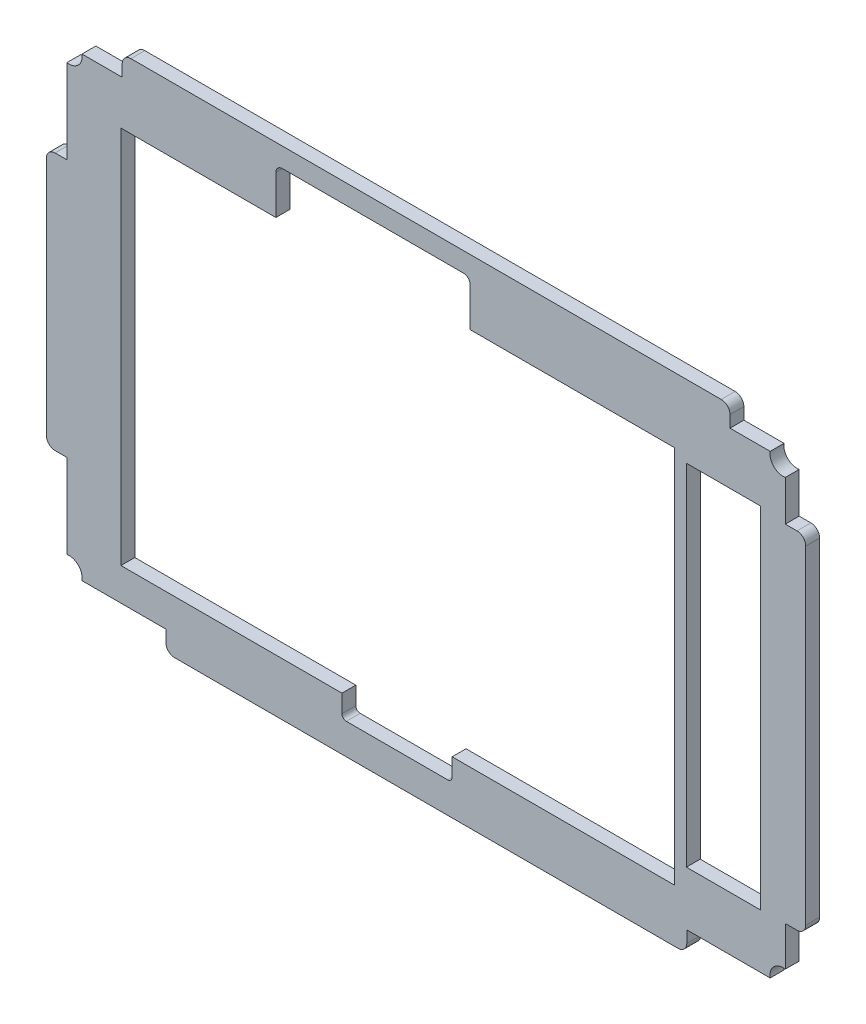
from build123d import *

# Parameters (mm, degrees)
BOSS_EXTRUDE1_DEPTH = 1.5875
SKETCH3_R           = 1.5
CUT_EXTRUDE1_DEPTH  = 1.5875
SKETCH4_W           = 8.5
SKETCH4_H           = 40
CUT_EXTRUDE2_DEPTH  = 52.910426175
CUT_EXTRUDE3_DEPTH  = 52.910426175


with BuildPart() as part:
    # Sketch2 → Boss-Extrude1 (new body)
    with BuildSketch(Plane.XY):
        with BuildLine():
            Line((41.075, 26.06487963), (34.753871084, 26.06487963))
            Line((34.753871084, 26.06487963), (34.753871084, 27.4075156))
            ThreePointArc((34.753871084, 27.4075156), (34.460977865, 28.114622381), (33.753871084, 28.4075156))
            Line((33.753871084, 28.4075156), (-33.743187521, 28.4075156))
            ThreePointArc((-33.743187521, 28.4075156), (-34.450294302, 28.114622381), (-34.743187521, 27.4075156))
            Line((-34.743187521, 27.4075156), (-34.743187521, 26.06487963))
            Line((-34.743187521, 26.06487963), (-41.075, 26.06487963))
            Line((-41.075, 26.06487963), (-41.075, 14.733067151))
            Line((-41.075, 14.733067151), (-42.4124996, 14.733067151))
            ThreePointArc((-42.4124996, 14.733067151), (-43.119606381, 14.440173932), (-43.4124996, 13.733067151))
            Line((-43.4124996, 13.733067151), (-43.4124996, -13.743187521))
            ThreePointArc((-43.4124996, -13.743187521), (-43.119606381, -14.450294302), (-42.4124996, -14.743187521))
            Line((-42.4124996, -14.743187521), (-41.075, -14.743187521))
            Line((-41.075, -14.743187521), (-41.075, -26.08512037))
            Line((-41.075, -26.08512037), (-29.75263109, -26.08512037))
            Line((-29.75263109, -26.08512037), (-29.75263109, -27.41690205))
            ThreePointArc((-29.75263109, -27.41690205), (-29.459737872, -28.124008831), (-28.75263109, -28.41690205))
            Line((-28.75263109, -28.41690205), (28.813455755, -28.41690205))
            ThreePointArc((28.813455755, -28.41690205), (29.520562536, -28.124008831), (29.813455755, -27.41690205))
            Line((29.813455755, -27.41690205), (29.813455755, -26.08512037))
            Line((29.813455755, -26.08512037), (41.075, -26.08512037))
            Line((41.075, -26.08512037), (41.075, -19.823575131))
            Line((41.075, -19.823575131), (42.412577294, -19.823575131))
            ThreePointArc((42.412577294, -19.823575131), (43.119684076, -19.530681912), (43.412577294, -18.823575131))
            Line((43.412577294, -18.823575131), (43.412577294, 18.721630511))
            ThreePointArc((43.412577294, 18.721630511), (43.119684076, 19.428737292), (42.412577294, 19.721630511))
            Line((42.412577294, 19.721630511), (41.075, 19.721630511))
            Line((41.075, 19.721630511), (41.075, 26.06487963))
        make_face()
    extrude(amount=BOSS_EXTRUDE1_DEPTH)

    # Sketch3 → Cut-Extrude1 (cut)
    with BuildSketch(Plane(origin=(0, 0, 0), x_dir=(-1, 0, 0), z_dir=(0, 0, -1))):
        with Locations((40.825, 25.825)):
            Circle(SKETCH3_R)
        with Locations((-40.825, 25.825)):
            Circle(SKETCH3_R)
        with Locations((-40.825, -25.825)):
            Circle(SKETCH3_R)
        with Locations((40.825, -25.825)):
            Circle(SKETCH3_R)
    extrude(amount=-CUT_EXTRUDE1_DEPTH, mode=Mode.SUBTRACT)

    # Sketch4 → Cut-Extrude2 (cut, through all)
    with BuildSketch(Plane(origin=(0, 0, 0), x_dir=(-1, 0, 0), z_dir=(0, 0, -1))):
        Polygon((-28.41, -20.51), (-28.41, 20.96), (34.89, 20.96), (34.89, -20.51), (34.89, -22.36), (-28.41, -22.36), align=None)
        with Locations((-34.015313808, 0.1)):
            Rectangle(SKETCH4_W, SKETCH4_H)
    extrude(amount=-CUT_EXTRUDE2_DEPTH, mode=Mode.SUBTRACT)

    # Sketch6 → Cut-Extrude3 (cut, through all)
    with BuildSketch(Plane(origin=(0, 0, 0), x_dir=(-1, 0, 0), z_dir=(0, 0, -1))):
        with BuildLine():
            Line((16.422031316, 26.18), (-4.280813202, 26.18))
            ThreePointArc((-4.280813202, 26.18), (-4.811143288, 25.960330086), (-5.030813202, 25.43))
            Line((-5.030813202, 25.43), (-5.030813202, 20.96))
            Line((-5.030813202, 20.96), (17.172031316, 20.96))
            Line((17.172031316, 20.96), (17.172031316, 25.43))
            ThreePointArc((17.172031316, 25.43), (16.952361402, 25.960330086), (16.422031316, 26.18))
        make_face()
        with BuildLine():
            Line((-2.978741709, -22.36), (9.619202587, -22.36))
            Line((9.619202587, -22.36), (9.619202587, -24.4))
            ThreePointArc((9.619202587, -24.4), (9.472755977, -24.753553391), (9.119202587, -24.9))
            Line((9.119202587, -24.9), (-2.478741709, -24.9))
            ThreePointArc((-2.478741709, -24.9), (-2.832295099, -24.753553391), (-2.978741709, -24.4))
            Line((-2.978741709, -24.4), (-2.978741709, -22.36))
        make_face()
    extrude(amount=-CUT_EXTRUDE3_DEPTH, mode=Mode.SUBTRACT)


solid = part.part
